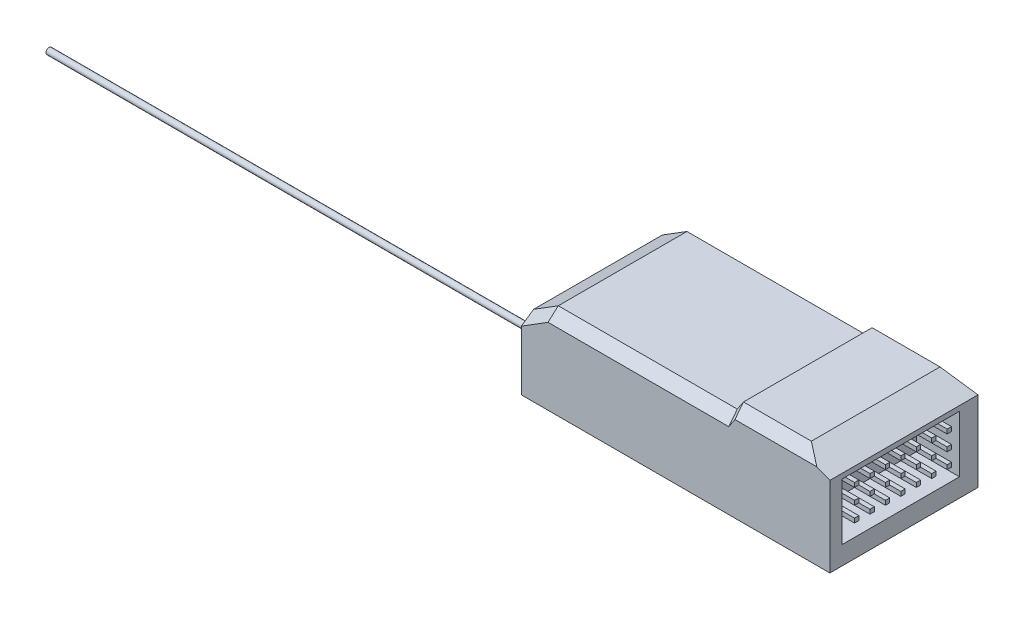
from build123d import *
from OCP.BRepFilletAPI import BRepFilletAPI_MakeChamfer

# Parameters (mm, degrees)
BOSS_EXTRUDE1_DEPTH  = 24
SKETCH2_W            = 19
SKETCH2_H            = 9.2
CUT_EXTRUDE1_DEPTH   = 7
SKETCH3_W            = 0.7
SKETCH3_H            = 0.7
BOSS_EXTRUDE2_DEPTH  = 7
LPATTERN1_COUNT      = 7
LPATTERN1_PITCH      = 2.5
LPATTERN1_COUNT_DIR2 = 3
LPATTERN1_PITCH_DIR2 = 2.5
CHAMFER1_SIZE        = 2
CHAMFER1_SIZE2       = 1.154700538
SKETCH5_R            = 1.5
BOSS_EXTRUDE3_DEPTH  = 1
SKETCH6_R            = 0.5
BOSS_EXTRUDE4_DEPTH  = 80


with BuildPart() as part:
    # Sketch1 → Boss-Extrude1 (new body)
    with BuildSketch(Plane.XY):
        Polygon((0, 0), (0, 11), (4, 13.5), (33, 13.5), (34, 15), (45, 15), (50, 13), (50, 0), align=None)
    extrude(amount=BOSS_EXTRUDE1_DEPTH)

    # Sketch2 → Cut-Extrude1 (cut)
    with BuildSketch(Plane(origin=(50, 0, 0), x_dir=(0, 0, -1), z_dir=(1, 0, 0))):
        with Locations((-12.5, 7.6)):
            Rectangle(SKETCH2_W, SKETCH2_H)
    extrude(amount=-CUT_EXTRUDE1_DEPTH, mode=Mode.SUBTRACT)

    # Sketch3 → Boss-Extrude2 (add)
    with BuildSketch(Plane(origin=(43, 0, 0), x_dir=(0, 0, -1), z_dir=(1, 0, 0))):
        with Locations((-19.65, 5.35)):
            Rectangle(SKETCH3_W, SKETCH3_H)
    boss_extrude2 = extrude(amount=BOSS_EXTRUDE2_DEPTH)

    # LPattern1: Boss-Extrude2 7 × 3
    with Locations(*[(0, j * LPATTERN1_PITCH_DIR2, -i * LPATTERN1_PITCH) for i in range(LPATTERN1_COUNT) for j in range(LPATTERN1_COUNT_DIR2) if (i, j) != (0, 0)]):
        add(boss_extrude2)

    # Chamfer1: one chamfer whose edges measure the first distance from different faces: ONE call of the kernel's chamfer builder (chamfer() names one face for all edges)
    chamfer1_edges_1 = [part.edges().sort_by_distance(p)[0] for p in [
        (39.5, 15, 0),
        (33.5, 14.25, 0),
        (18.5, 13.5, 0),
        (2, 12.25, 0),
    ]]
    chamfer1_side_1 = [part.faces().sort_by_distance(p)[0] for p in [
        (25.603358705, 6.920985864, 0),
    ]]
    chamfer1_edges_2 = [part.edges().sort_by_distance(p)[0] for p in [
        (39.5, 15, 24),
    ]]
    chamfer1_side_2 = [part.faces().sort_by_distance(p)[0] for p in [
        (39.5, 15, 12),
    ]]
    chamfer1_edges_3 = [part.edges().sort_by_distance(p)[0] for p in [
        (33.5, 14.25, 24),
    ]]
    chamfer1_side_3 = [part.faces().sort_by_distance(p)[0] for p in [
        (33.5, 14.25, 12),
    ]]
    chamfer1_edges_4 = [part.edges().sort_by_distance(p)[0] for p in [
        (2, 12.25, 24),
    ]]
    chamfer1_side_4 = [part.faces().sort_by_distance(p)[0] for p in [
        (2, 12.25, 12),
    ]]
    chamfer1_edges_5 = [part.edges().sort_by_distance(p)[0] for p in [
        (18.5, 13.5, 24),
    ]]
    chamfer1_side_5 = [part.faces().sort_by_distance(p)[0] for p in [
        (18.5, 13.5, 12),
    ]]
    chamfer1 = BRepFilletAPI_MakeChamfer(part.part.solid().wrapped)
    for e in chamfer1_edges_1:
        chamfer1.Add(CHAMFER1_SIZE, CHAMFER1_SIZE2, e.wrapped, chamfer1_side_1[0].wrapped)  # the first distance lies on this face
    for e in chamfer1_edges_2:
        chamfer1.Add(CHAMFER1_SIZE, CHAMFER1_SIZE2, e.wrapped, chamfer1_side_2[0].wrapped)  # the first distance lies on this face
    for e in chamfer1_edges_3:
        chamfer1.Add(CHAMFER1_SIZE, CHAMFER1_SIZE2, e.wrapped, chamfer1_side_3[0].wrapped)  # the first distance lies on this face
    for e in chamfer1_edges_4:
        chamfer1.Add(CHAMFER1_SIZE, CHAMFER1_SIZE2, e.wrapped, chamfer1_side_4[0].wrapped)  # the first distance lies on this face
    for e in chamfer1_edges_5:
        chamfer1.Add(CHAMFER1_SIZE, CHAMFER1_SIZE2, e.wrapped, chamfer1_side_5[0].wrapped)  # the first distance lies on this face
    add(Compound.cast(chamfer1.Shape()), mode=Mode.REPLACE)

    # Sketch5 → Boss-Extrude3 (add)
    with BuildSketch(Plane.ZY):
        with Locations(Location((19.5, 5.5, 0), (0, 0, 180))):
            Circle(SKETCH5_R)
    extrude(amount=BOSS_EXTRUDE3_DEPTH)

    # Sketch6 → Boss-Extrude4 (add)
    with BuildSketch(Plane.ZY.offset(1)):
        with Locations((19.5, 5.5)):
            Circle(SKETCH6_R)
    extrude(amount=BOSS_EXTRUDE4_DEPTH)


solid = part.part
